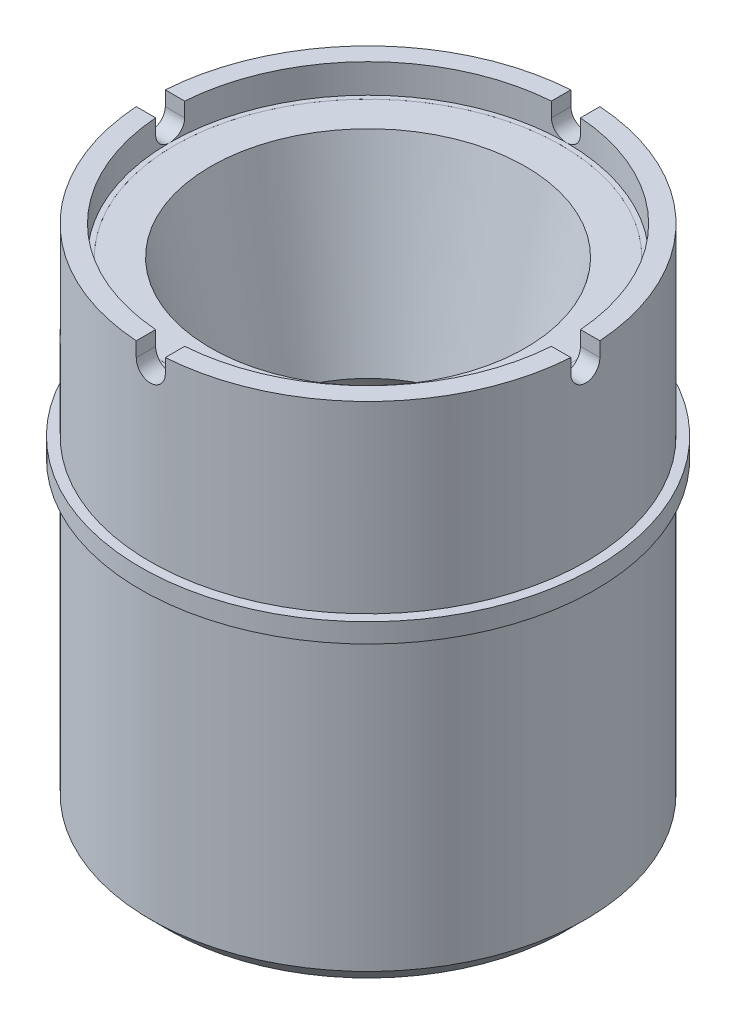
from build123d import *

# Parameters (mm, degrees)
SKETCH_1_W               = 1
SKETCH_1_H               = 2
SKETCH_1_W_2             = 2
SKETCH_1_H_2             = 3
CUT_EXTRUDE_1_REACH      = 64.558
CUT_EXTRUDE_1_END_RADIUS = 22.5
PATTERN_CIRCULAR_1_COUNT = 4
CHAMFER_1_SIZE           = 2


with BuildPart() as part:
    # 草图1 → Revolve 2266 (revolve)
    with BuildSketch(Plane.XY, mode=Mode.PRIVATE) as revolve_2266_sk:
        Polygon((19, 4), (0, 4), (0, 0), (22.5, 0), (22.5, 50), (20, 50), (20, 48), (19, 48), align=None)
        with Locations((18.5, 5)):
            Rectangle(SKETCH_1_W, SKETCH_1_H)
        with Locations((21.5, 51.5)):
            Rectangle(SKETCH_1_W_2, SKETCH_1_H_2)
        with Locations((23, 33)):
            Rectangle(SKETCH_1_W, SKETCH_1_H)
    revolve(revolve_2266_sk.sketch.rotate(Axis((0, 0, 0), (0, 1, 0)), 90), axis=Axis((0, 0, 0), (0, 1, 0)))

    # 切除-拉伸1: up to this cylinder (the profile starts inside it)
    cut_extrude_1_end = Plane(origin=(0, 51.640025, 0), z_dir=(0, -1, 0)) * Cylinder(CUT_EXTRUDE_1_END_RADIUS, 175.116, mode=Mode.PRIVATE)
    # 草图4 → 切除-拉伸1 (cut, up to the surface)
    with BuildSketch(Plane.XY, mode=Mode.PRIVATE) as cut_extrude_1_sk1:
        with BuildLine():
            Line((0, 50), (0, 53))
            Line((0, 53), (-1.5, 53))
            Line((-1.5, 53), (-1.5, 51.5))
            ThreePointArc((-1.5, 51.5), (-1.060660173, 50.439339829), (-3e-09, 50))
        make_face()
    cut_extrude_1_tool1 = extrude(cut_extrude_1_sk1.sketch, amount=-CUT_EXTRUDE_1_REACH, mode=Mode.PRIVATE) & cut_extrude_1_end
    # 草图4 → 切除-拉伸1 (cut, up to the surface)
    with BuildSketch(Plane.XY, mode=Mode.PRIVATE) as cut_extrude_1_sk2:
        with BuildLine():
            Line((1.5, 53), (0, 53))
            Line((0, 53), (0, 50))
            ThreePointArc((-3e-09, 50), (1.060660171, 50.439339827), (1.5, 51.5))
            Line((1.5, 51.5), (1.5, 53))
        make_face()
    cut_extrude_1_tool2 = extrude(cut_extrude_1_sk2.sketch, amount=-CUT_EXTRUDE_1_REACH, mode=Mode.PRIVATE) & cut_extrude_1_end
    cut_extrude_1 = cut_extrude_1_tool1.solids().sort_by_distance((-0.700124, 51.640025, 0))[0] + cut_extrude_1_tool2.solids().sort_by_distance((0.700124, 51.640025, 0))[0]
    add(cut_extrude_1, mode=Mode.SUBTRACT)

    # 阵列(圆周)1: 切除-拉伸1 ×4 about axis
    pattern_circular_1_axis = Axis((0, 0, 0), (0, 1, 0))
    for i in range(1, PATTERN_CIRCULAR_1_COUNT):
        add(cut_extrude_1.rotate(pattern_circular_1_axis, i * 360 / PATTERN_CIRCULAR_1_COUNT), mode=Mode.SUBTRACT)

    # 倒角1
    chamfer_1_edges = [part.edges().sort_by_distance(p)[0] for p in [
        (0, 0, 22.5),
    ]]
    chamfer(chamfer_1_edges, length=CHAMFER_1_SIZE)


with BuildPart() as body_2:
    # 草图2 → Revolve 2503 (revolve)
    with BuildSketch(Plane.XY, mode=Mode.PRIVATE) as revolve_2503_sk:
        with BuildLine():
            Line((19, 13), (19, 24.5))
            Line((19, 24.5), (13.5, 24.5))
            ThreePointArc((13.5, 24.5), (9.545941546, 14.954058454), (0, 11))
            Line((0, 11), (0, 4))
            Line((0, 4), (18, 4))
            Line((18, 4), (18, 6))
            Line((18, 6), (19, 6))
            Line((19, 6), (19, 13))
        make_face()
    revolve(revolve_2503_sk.sketch.rotate(Axis((0, 0, 0), (0, 1, 0)), 180), axis=Axis((0, 0, 0), (0, 1, 0)))


with BuildPart() as body_3:
    # 草图3 → Revolve 2701 (revolve)
    with BuildSketch(Plane.XY, mode=Mode.PRIVATE) as revolve_2701_sk:
        with BuildLine():
            Line((19, 48), (20, 48))
            Line((20, 48), (20, 50))
            Line((20, 50), (16.257063968, 50))
            Line((16.257063968, 50), (12.006534401, 30.671963356))
            ThreePointArc((12.006534401, 30.671963356), (13.121322617, 27.675042172), (13.5, 24.5))
            Line((13.5, 24.5), (19, 24.5))
            Line((19, 24.5), (19, 48))
        make_face()
    revolve(revolve_2701_sk.sketch.rotate(Axis((0, 50, 0), (0, -1, 0)), 180), axis=Axis((0, 50, 0), (0, -1, 0)))


solid = Compound([part.part, body_2.part, body_3.part])
